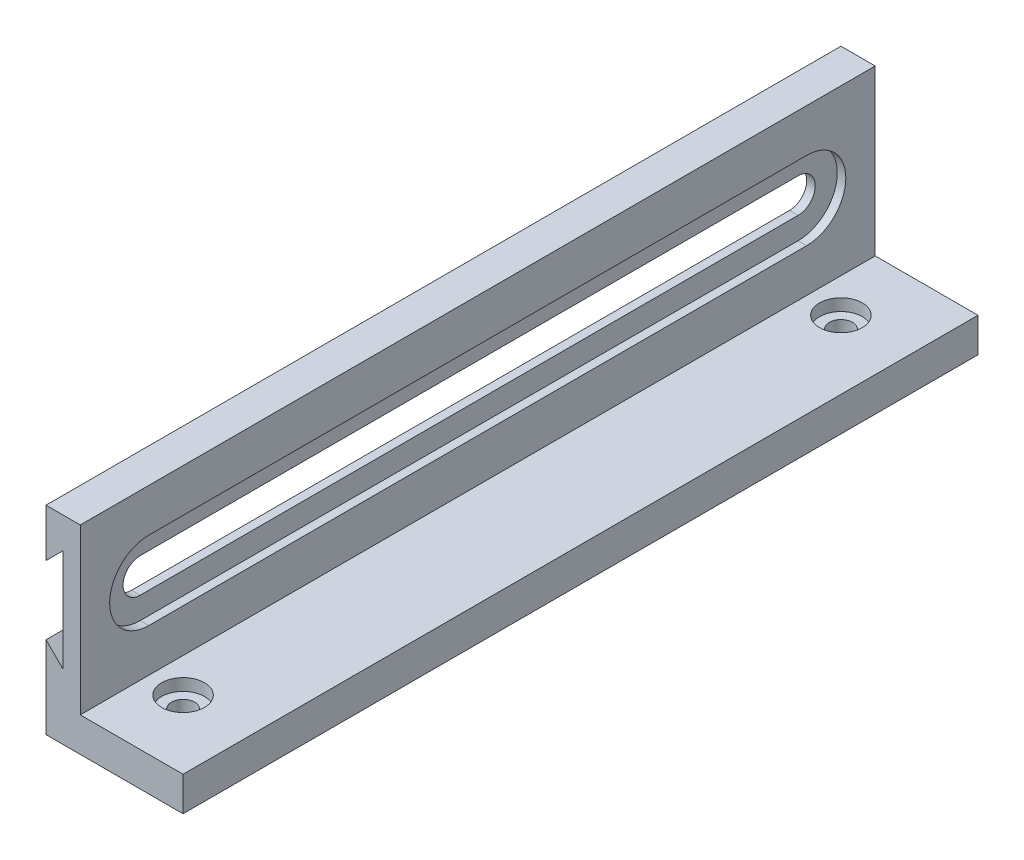
from build123d import *

# Parameters (mm, degrees)
SKETCH1_W                                           = 25.4
SKETCH1_H                                           = 147.32
BOSS_EXTRUDE1_DEPTH                                 = 6.35
SKETCH2_W                                           = 147.32
SKETCH2_H                                           = 30.48
BOSS_EXTRUDE2_DEPTH                                 = 6.35
CBORE_FOR_6_BINDING_HEAD_MACHINE_SCREW1_D           = 4.3053
CBORE_FOR_6_BINDING_HEAD_MACHINE_SCREW1_CBORE_D     = 7.9375
CBORE_FOR_6_BINDING_HEAD_MACHINE_SCREW1_CBORE_DEPTH = 2.2098
CUT_EXTRUDE1_DEPTH                                  = 152.641403647
CUT_EXTRUDE2_DEPTH                                  = 1.5875
CUT_EXTRUDE3_DEPTH                                  = 153.569239364


with BuildPart() as part:
    # Sketch1 → Boss-Extrude1 (new body)
    with BuildSketch(Plane(origin=(0, 0, 0), x_dir=(1, 0, 0), z_dir=(0, 1, 0))):
        with Locations((12.7, 73.66)):
            Rectangle(SKETCH1_W, SKETCH1_H)
    extrude(amount=-BOSS_EXTRUDE1_DEPTH)

    # Sketch2 → Boss-Extrude2 (add)
    with BuildSketch(Plane.ZY):
        with Locations((-73.66, 15.24)):
            Rectangle(SKETCH2_W, SKETCH2_H)
    extrude(amount=-BOSS_EXTRUDE2_DEPTH)

    # CBORE for #6 Binding Head Machine Screw1 (through all)
    with Locations(Plane(origin=(0, 0, 0), x_dir=(1, 0, 0), z_dir=(0, 1, 0))):
        with Locations((12.7, 12.7), (12.7, 134.62)):
            CounterBoreHole(CBORE_FOR_6_BINDING_HEAD_MACHINE_SCREW1_D / 2, CBORE_FOR_6_BINDING_HEAD_MACHINE_SCREW1_CBORE_D / 2, CBORE_FOR_6_BINDING_HEAD_MACHINE_SCREW1_CBORE_DEPTH)

    # Sketch9 → Cut-Extrude1 (cut, through all)
    with BuildSketch(Plane(origin=(6.35, 0, 0), x_dir=(0, 0, -1), z_dir=(1, 0, 0))):
        with BuildLine():
            Line((12.7, 18.415), (134.62, 18.415))
            ThreePointArc((134.62, 18.415), (137.795, 15.24), (134.62, 12.065))
            Line((134.62, 12.065), (12.7, 12.065))
            ThreePointArc((12.7, 12.065), (9.525, 15.24), (12.7, 18.415))
        make_face()
    extrude(amount=-CUT_EXTRUDE1_DEPTH, mode=Mode.SUBTRACT)

    # Sketch12 → Cut-Extrude2 (cut)
    with BuildSketch(Plane(origin=(6.35, 0, 0), x_dir=(0, 0, -1), z_dir=(1, 0, 0))):
        with BuildLine():
            Line((12.7, 22.493732), (134.62, 22.493732))
            ThreePointArc((134.62, 22.493732), (141.873732, 15.24), (134.62, 7.986268))
            Line((134.62, 7.986268), (12.7, 7.986268))
            ThreePointArc((12.7, 7.986268), (5.446268, 15.24), (12.7, 22.493732))
        make_face()
    extrude(amount=-CUT_EXTRUDE2_DEPTH, mode=Mode.SUBTRACT)

    # Sketch13 → Cut-Extrude3 (cut, through all)
    with BuildSketch(Plane(origin=(0, 0, -147.32), x_dir=(-1, 0, 0), z_dir=(0, 0, -1))):
        Polygon((0, 21.59), (0, 8.89), (-3.175, 5.715), (-3.175, 24.765), align=None)
    extrude(amount=-CUT_EXTRUDE3_DEPTH, mode=Mode.SUBTRACT)


solid = part.part
